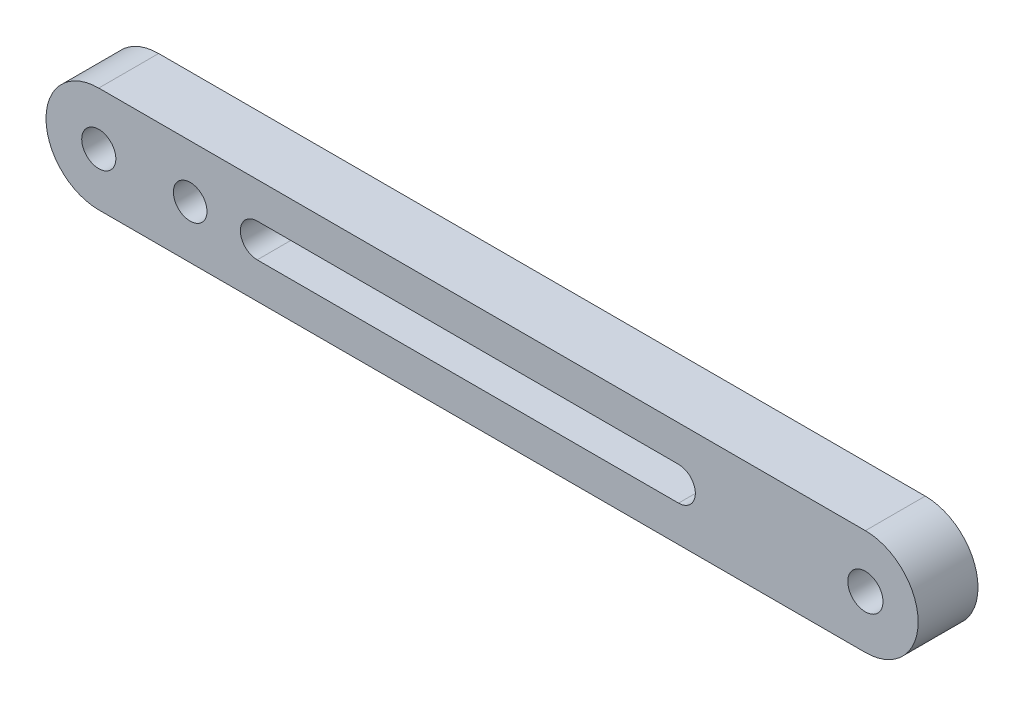
from build123d import *

# Parameters (mm, degrees)
EXTRUDE_1_DEPTH      = 2.2
EXTRUDE_2_DEPTH      = 3.25
SKETCH_3_W           = 50
SKETCH_3_H           = 10.05
EXTRUDE_3_DEPTH      = 3.25
CUT_EXTRUDE_1_DEPTH  = 30
EXTRUDE_4_REACH      = 56.389
SKETCH_6_R           = 5.025
SKETCH_8_R           = 1.675
SKETCH_8_R_2         = 0.84
CUT_EXTRUDE_3_DEPTH  = 55
SKETCH_9_W           = 28.473000816
SKETCH_9_H           = 14.532409192
CUT_EXTRUDE_4_DEPTH  = 3
EXTRUDE_5_DEPTH      = 2.45
SKETCH_11_W          = 12.614203935
SKETCH_11_H          = 10.05
EXTRUDE_6_DEPTH      = 3
SKETCH_12_W          = 36.628466797
SKETCH_12_H          = 15.348537224
CUT_EXTRUDE_5_DEPTH  = 10
SKETCH_13_W          = 5.35
SKETCH_13_H          = 5.35
CUT_EXTRUDE_6_DEPTH  = 14
SKETCH_14_R          = 1.1
CUT_EXTRUDE_7_DEPTH  = 14
SKETCH_15_R          = 1.1
CUT_EXTRUDE_8_DEPTH  = 10
SKETCH_16_R          = 1.625
EXTRUDE_7_DEPTH      = 5.7
SKETCH_17_W          = 19.923143876
SKETCH_17_H          = 15.083058075
CUT_EXTRUDE_9_DEPTH  = 3
SKETCH_18_R          = 1.675
SKETCH_18_R_2        = 1.6
CUT_EXTRUDE_10_DEPTH = 6


with BuildPart() as part:
    # 草图1 → 凸台-拉伸1 (new body)
    with BuildSketch(Plane.XY):
        with BuildLine():
            Line((1.539836705, 12.851012384), (15.55297303, 14.251012384))
            ThreePointArc((15.55297303, 14.251012384), (17.193415997, 16.063512384), (15.55297303, 17.876012384))
            Line((15.55297303, 17.876012384), (1.500532553, 18.901012384))
            ThreePointArc((1.500532553, 18.901012384), (0.527100583, 19.384612538), (-0.54702697, 19.551012384))
            Line((-0.54702697, 19.551012384), (-0.54702697, 20.901012384))
            Line((-0.54702697, 20.901012384), (19.51277613, 20.901012384))
            Line((19.51277613, 20.901012384), (41.45297303, 20.901012384))
            Line((41.45297303, 20.901012384), (41.45297303, 10.851012384))
            Line((41.45297303, 10.851012384), (-0.54702697, 10.851012384))
            Line((-0.54702697, 10.851012384), (-0.54702697, 12.201012384))
            ThreePointArc((-0.54702697, 12.201012384), (0.54584768, 12.367273294), (1.539836705, 12.851012384))
        make_face()
    extrude(amount=EXTRUDE_1_DEPTH)

    # 草图2 → 凸台-拉伸2 (add)
    with BuildSketch(Plane(origin=(0, 0, 0), x_dir=(-1, 0, 0), z_dir=(0, 0, -1))):
        Polygon((-19.51277613, 10.851012384), (-49.45297303, 10.851012384), (-49.45297303, 20.901012384), (-19.51277613, 20.901012384), (0.54702697, 20.901012384), (0.54702697, 10.851012384), align=None)
    extrude(amount=EXTRUDE_2_DEPTH)

    # 草图3 → 凸台-拉伸3 (add)
    with BuildSketch(Plane.XY.offset(2.2)):
        with Locations((24.45297303, 15.876012384)):
            Rectangle(SKETCH_3_W, SKETCH_3_H)
    extrude(amount=EXTRUDE_3_DEPTH)

    # 草图4 → 切除-拉伸1 (cut, symmetric)
    with BuildSketch(Plane.XY):
        with BuildLine():
            Line((-0.54702697, 19.551012384), (-2.235397712, 16.616091152))
            Line((-2.235397712, 16.616091152), (-1.110896638, 12.310548833))
            Line((-1.110896638, 12.310548833), (-0.54702697, 12.201012384))
            ThreePointArc((-0.54702697, 12.201012384), (0.54584768, 12.367273294), (1.539836705, 12.851012384))
            ThreePointArc((1.539836705, 12.851012384), (2.773180655, 15.88415254), (1.500532553, 18.901012384))
            ThreePointArc((1.500532553, 18.901012384), (0.527100583, 19.384612538), (-0.54702697, 19.551012384))
        make_face()
    extrude(amount=CUT_EXTRUDE_1_DEPTH, both=True, mode=Mode.SUBTRACT)

    # 凸台-拉伸4: up to this face of the body (flat: up to its plane)
    extrude_4_end = Plane(part.part.faces().sort_by_distance((25.407741746, 15.876338503, 5.45))[0])
    # 草图6 → 凸台-拉伸4 (add, up to the picked face)
    with BuildSketch(Plane(origin=(0, 0, -3.25), x_dir=(-1, 0, 0), z_dir=(0, 0, -1)), mode=Mode.PRIVATE) as extrude_4_sk1:
        with Locations(Location((-49.45297303, 15.876012384, 0), (0, 0, 90))):
            Circle(SKETCH_6_R)
    extrude_4_tool1 = split(extrude(extrude_4_sk1.sketch, amount=-EXTRUDE_4_REACH, mode=Mode.PRIVATE), bisect_by=extrude_4_end, keep=Keep.BOTH, mode=Mode.PRIVATE)
    add(extrude_4_tool1.solids().sort_by(Axis((49.452973, 15.876012, -3.25), (0, 0, 1)))[0])

    # 草图8 → 切除-拉伸3 (cut)
    with BuildSketch(Plane(origin=(0, 0, -3.25), x_dir=(-1, 0, 0), z_dir=(0, 0, -1))):
        with Locations((-49.45297303, 15.876012384)):
            Circle(SKETCH_8_R)
        with Locations(Location((-7.95297303, 15.856360308, 0), (0, 0, 180))):
            Circle(SKETCH_8_R_2)
    extrude(amount=-CUT_EXTRUDE_3_DEPTH, mode=Mode.SUBTRACT)

    # 草图9 → 切除-拉伸4 (cut)
    with BuildSketch(Plane(origin=(0, 0, -3.25), x_dir=(-1, 0, 0), z_dir=(0, 0, -1))):
        with Locations((-42.648638606, 15.039406696)):
            Rectangle(SKETCH_9_W, SKETCH_9_H)
    extrude(amount=-CUT_EXTRUDE_4_DEPTH, mode=Mode.SUBTRACT)

    # 草图10 → 凸台-拉伸5 (add)
    with BuildSketch(Plane(origin=(0, 0, 2.2), x_dir=(-1, 0, 0), z_dir=(0, 0, -1))):
        with BuildLine():
            Line((-49.45297303, 20.901012384), (-38.466384114, 20.901012384))
            Line((-38.466384114, 20.901012384), (-38.466384114, 10.851012384))
            Line((-38.466384114, 10.851012384), (-49.45297303, 10.851012384))
            ThreePointArc((-49.45297303, 10.851012384), (-46.217908976, 15.876012384), (-49.45297303, 20.901012384))
        make_face()
    extrude(amount=EXTRUDE_5_DEPTH)

    # 草图11 → 凸台-拉伸6 (add)
    with BuildSketch(Plane(origin=(0, 0, -3.25), x_dir=(-1, 0, 0), z_dir=(0, 0, -1))):
        with Locations((-32.625453647, 15.876012384)):
            Rectangle(SKETCH_11_W, SKETCH_11_H)
    extrude(amount=-EXTRUDE_6_DEPTH)

    # 草图12 → 切除-拉伸5 (cut)
    with BuildSketch(Plane(origin=(0, 0, -3.25), x_dir=(-1, 0, 0), z_dir=(0, 0, -1))):
        with Locations((-5.618322216, 15.103365543)):
            Rectangle(SKETCH_12_W, SKETCH_12_H)
    extrude(amount=-CUT_EXTRUDE_5_DEPTH, mode=Mode.SUBTRACT)

    # 草图13 → 切除-拉伸6 (cut)
    with BuildSketch(Plane.ZY.offset(-23.932555614)):
        with Locations((1.1, 16.124405573)):
            Rectangle(SKETCH_13_W, SKETCH_13_H)
    extrude(amount=-CUT_EXTRUDE_6_DEPTH, mode=Mode.SUBTRACT)

    # 草图14 → 切除-拉伸7 (cut)
    with BuildSketch(Plane(origin=(0, 20.901012384, 0), x_dir=(1, 0, 0), z_dir=(0, 1, 0))):
        with Locations(Location((30.538219594, -1.1, 0), (0, 0, 270))):
            Circle(SKETCH_14_R)
    extrude(amount=-CUT_EXTRUDE_7_DEPTH, mode=Mode.SUBTRACT)

    # 草图15 → 切除-拉伸8 (cut)
    with BuildSketch(Plane.XY.offset(5.45)):
        with Locations((36.879929969, 15.882801083)):
            Circle(SKETCH_15_R)
    extrude(amount=-CUT_EXTRUDE_8_DEPTH, mode=Mode.SUBTRACT)

    # 草图16 → 凸台-拉伸7 (add)
    with BuildSketch(Plane(origin=(0, 0, -0.25), x_dir=(-1, 0, 0), z_dir=(0, 0, -1))):
        with BuildLine():
            Line((-49.45297303, 20.901012384), (23.54702697, 20.901012384))
            ThreePointArc((23.54702697, 20.901012384), (28.57202697, 15.876012384), (23.54702697, 10.851012384))
            Line((23.54702697, 10.851012384), (-49.45297303, 10.851012384))
            Line((-49.45297303, 10.851012384), (-49.45297303, 20.901012384))
        make_face()
        with Locations((23.54702697, 15.876012384)):
            Circle(SKETCH_16_R, mode=Mode.SUBTRACT)
    extrude(amount=-EXTRUDE_7_DEPTH)

    # 草图17 → 切除-拉伸9 (cut)
    with BuildSketch(Plane(origin=(0, 0, -3.25), x_dir=(-1, 0, 0), z_dir=(0, 0, -1))):
        with Locations((-33.178239607, 16.007261263)):
            Rectangle(SKETCH_17_W, SKETCH_17_H)
    extrude(amount=-CUT_EXTRUDE_9_DEPTH, mode=Mode.SUBTRACT)

    # 草图18 → 切除-拉伸10 (cut)
    with BuildSketch(Plane(origin=(0, 0, -0.25), x_dir=(-1, 0, 0), z_dir=(0, 0, -1))):
        with Locations(Location((-49.45297303, 15.876012384, 0), (0, 0, 180))):
            Circle(SKETCH_18_R)
        with Locations((14.84318256, 15.876012384)):
            Circle(SKETCH_18_R_2)
        with BuildLine():
            Line((-31.661597205, 17.476012384), (8.461046927, 17.476012384))
            ThreePointArc((8.461046927, 17.476012384), (10.061046927, 15.876012384), (8.461046927, 14.276012384))
            Line((8.461046927, 14.276012384), (-31.661597205, 14.276012384))
            ThreePointArc((-31.661597205, 14.276012384), (-33.261597205, 15.876012384), (-31.661597205, 17.476012384))
        make_face()
    extrude(amount=-CUT_EXTRUDE_10_DEPTH, mode=Mode.SUBTRACT)


solid = part.part
